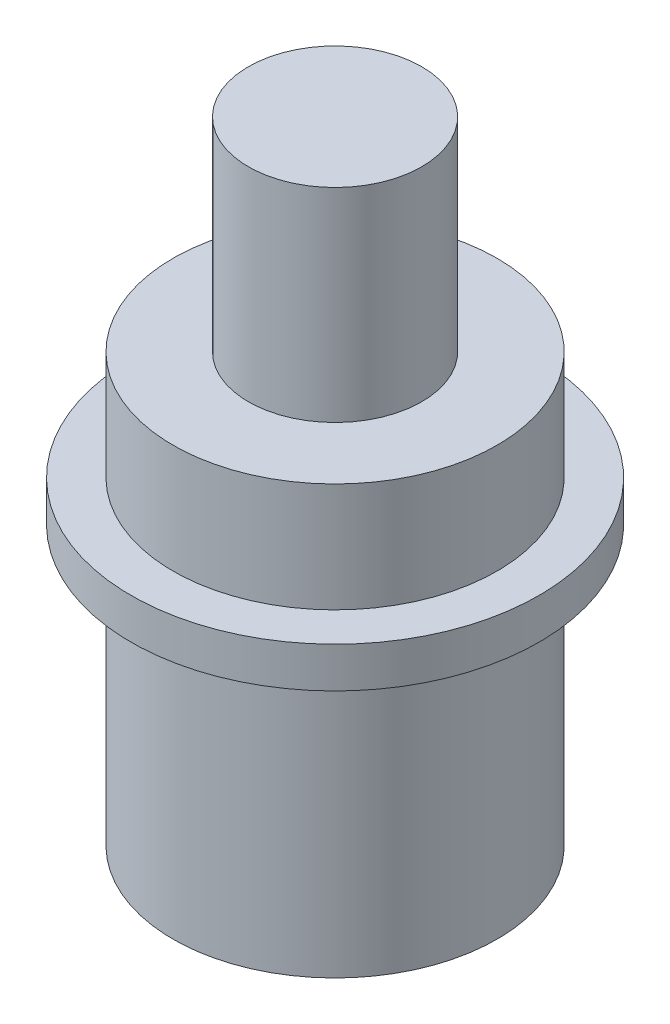
from build123d import *

# Parameters (mm, degrees)
CUT_EXTRUDE_START   = -4.02
SKETCH_2_R          = 1.67
CUT_EXTRUDE_1_DEPTH = 4.02


with BuildPart() as part:
    # 草图1 → 旋转1 (revolve)
    with BuildSketch(Plane.XY, mode=Mode.PRIVATE) as revolve_1_sk:
        Polygon((0, 0), (3.12, 0), (3.12, 5.36), (3.93, 5.36), (3.93, 6.14), (3.12, 6.14), (3.12, 8.24), (1.67, 8.24), (1.67, 12.16), (0, 12.16), align=None)
    revolve(revolve_1_sk.sketch.rotate(Axis((0, 0, 0), (0, 1, 0)), 90), axis=Axis((0, 0, 0), (0, 1, 0)))

    # 草图2 → 切除-拉伸1 (cut)
    with BuildSketch(Plane.XZ.offset(CUT_EXTRUDE_START)):
        with Locations(Location((0, 0, 0), (0, 0, 270))):
            Circle(SKETCH_2_R)
    extrude(amount=CUT_EXTRUDE_1_DEPTH, mode=Mode.SUBTRACT)

    # 草图3 → 切除-旋转1 (revolve, cut)
    with BuildSketch(Plane.XY, mode=Mode.PRIVATE) as cut_revolve_1_sk:
        Polygon((2.62, 0), (1.67, 0.95), (0, 0.95), (0, 0), align=None)
    revolve(cut_revolve_1_sk.sketch.rotate(Axis((0, 0, 0), (0, -1, 0)), 90), axis=Axis((0, 0, 0), (0, -1, 0)), mode=Mode.SUBTRACT)


solid = part.part
